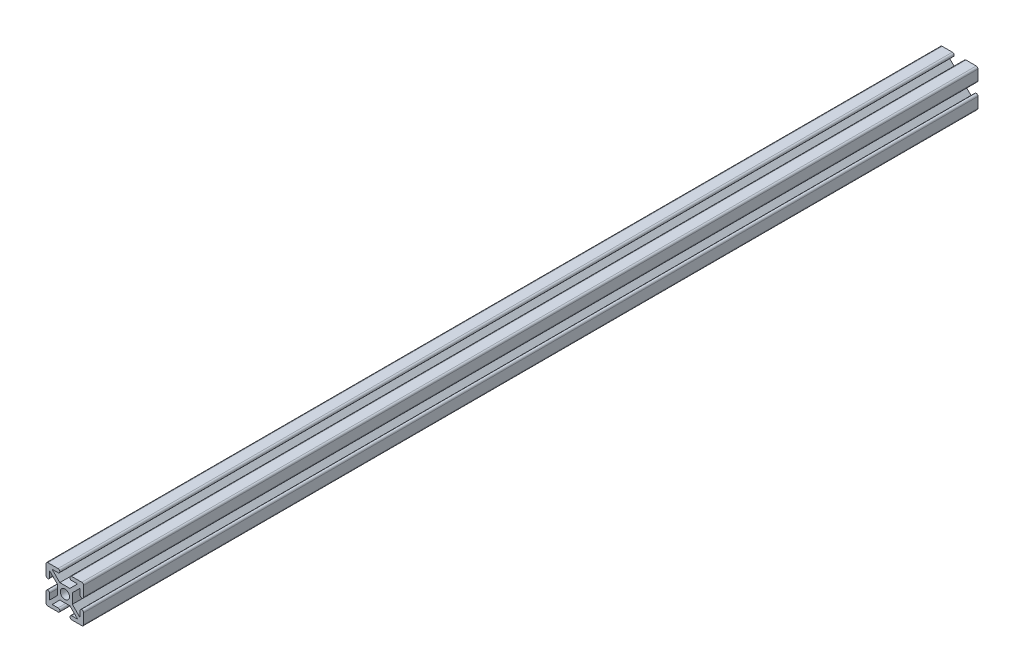
from build123d import *

# Parameters (mm, degrees)
SKETCH1_R           = 3.645
BOSS_EXTRUDE1_DEPTH = 713.12
SKETCH2_R           = 4
CUT_EXTRUDE1_DEPTH  = 30
SKETCH3_R           = 4
CUT_EXTRUDE2_DEPTH  = 30
SKETCH5_R           = 4
CUT_EXTRUDE3_DEPTH  = 30


with BuildPart() as part:
    # Sketch1 → Boss-Extrude1 (new body)
    with BuildSketch(Plane.XY):
        with BuildLine():
            Line((-0.896091737, 13.201013623), (3.828908263, 13.201013623))
            Line((3.828908263, 13.201013623), (-2.321091737, 19.351013623))
            Line((-2.321091737, 19.351013623), (-10.321091737, 19.351013623))
            Line((-10.321091737, 19.351013623), (-16.471091737, 13.201013623))
            Line((-16.471091737, 13.201013623), (-11.746091737, 13.201013623))
            ThreePointArc((-11.746091737, 13.201013623), (-10.321091737, 11.776013623), (-11.746091737, 10.351013623))
            Line((-11.746091737, 10.351013623), (-19.92252751, 10.377449395))
            ThreePointArc((-19.92252751, 10.377449395), (-20.911461759, 10.787079374), (-21.321091737, 11.776013623))
            Line((-21.321091737, 11.776013623), (-21.321091737, 19.926013623))
            ThreePointArc((-21.321091737, 19.926013623), (-19.92252751, 21.32457785), (-18.523963282, 19.926013623))
            Line((-18.523963282, 19.926013623), (-18.523963282, 15.201013623))
            Line((-18.523963282, 15.201013623), (-12.373963282, 21.351013623))
            Line((-12.373963282, 21.351013623), (-12.373963282, 29.351013623))
            Line((-12.373963282, 29.351013623), (-18.523963282, 35.501013623))
            Line((-18.523963282, 35.501013623), (-18.523963282, 30.776013623))
            ThreePointArc((-18.523963282, 30.776013623), (-19.948963282, 29.351013623), (-21.373963282, 30.776013623))
            Line((-21.373963282, 30.776013623), (-21.373963282, 38.925967033))
            ThreePointArc((-21.373963282, 38.925967033), (-20.956590446, 39.933594196), (-19.948963282, 40.350967033))
            Line((-19.948963282, 40.350967033), (-11.798963282, 40.350967033))
            ThreePointArc((-11.798963282, 40.350967033), (-10.373963282, 38.925967033), (-11.798963282, 37.500967033))
            Line((-11.798963282, 37.500967033), (-16.523963282, 37.500967033))
            Line((-16.523963282, 37.500967033), (-10.373963282, 31.350967033))
            Line((-10.373963282, 31.350967033), (-2.373963282, 31.350967033))
            Line((-2.373963282, 31.350967033), (3.776036718, 37.500967033))
            Line((3.776036718, 37.500967033), (-0.948963282, 37.500967033))
            ThreePointArc((-0.948963282, 37.500967033), (-2.373963282, 38.925967033), (-0.948963282, 40.350967033))
            Line((-0.948963282, 40.350967033), (7.201036718, 40.350967033))
            ThreePointArc((7.201036718, 40.350967033), (8.208663881, 39.933594196), (8.626036718, 38.925967033))
            Line((8.626036718, 38.925967033), (8.626036718, 30.879710718))
            ThreePointArc((8.626036718, 30.879710718), (7.201036718, 29.454710718), (5.776036718, 30.879710718))
            Line((5.776036718, 30.879710718), (5.776036718, 35.500967033))
            Line((5.776036718, 35.500967033), (-0.373963282, 29.350967033))
            Line((-0.373963282, 29.350967033), (-0.373963282, 21.350967033))
            Line((-0.373963282, 21.350967033), (5.776036718, 15.200967033))
            Line((5.776036718, 15.200967033), (5.776036718, 20.029710718))
            ThreePointArc((5.776036718, 20.029710718), (7.201036718, 21.454710718), (8.626036718, 20.029710718))
            Line((8.626036718, 20.029710718), (8.626036718, 11.776013623))
            ThreePointArc((8.626036718, 11.776013623), (8.208663881, 10.768386459), (7.201036718, 10.351013623))
            Line((7.201036718, 10.351013623), (-0.896091737, 10.351013623))
            ThreePointArc((-0.896091737, 10.351013623), (-2.321091737, 11.776013623), (-0.896091737, 13.201013623))
        make_face()
        with Locations((-6.321091737, 25.351013623)):
            Circle(SKETCH1_R, mode=Mode.SUBTRACT)
    extrude(amount=BOSS_EXTRUDE1_DEPTH)

    # Sketch2 → Cut-Extrude1 (cut)
    with BuildSketch(Plane(origin=(-0.373963282, 0, 0), x_dir=(0, 0, -1), z_dir=(1, 0, 0))):
        with Locations(Location((-694.28, 25.350967033, 0), (0, 0, 90))):
            Circle(SKETCH2_R)
    extrude(amount=-CUT_EXTRUDE1_DEPTH, mode=Mode.SUBTRACT)

    # Sketch3 → Cut-Extrude2 (cut)
    with BuildSketch(Plane(origin=(-0.373963282, 0, 0), x_dir=(0, 0, -1), z_dir=(1, 0, 0))):
        with Locations(Location((-637.98, 25.350967033, 0), (0, 0, 90))):
            Circle(SKETCH3_R)
    extrude(amount=-CUT_EXTRUDE2_DEPTH, mode=Mode.SUBTRACT)

    # Sketch5 → Cut-Extrude3 (cut)
    with BuildSketch(Plane(origin=(-0.373963282, 0, 0), x_dir=(0, 0, -1), z_dir=(1, 0, 0))):
        with Locations(Location((-18.84, 25.350967033, 0), (0, 0, 90))):
            Circle(SKETCH5_R)
        with Locations(Location((-75.14, 25.350967033, 0), (0, 0, 90))):
            Circle(SKETCH5_R)
    extrude(amount=-CUT_EXTRUDE3_DEPTH, mode=Mode.SUBTRACT)


solid = part.part
